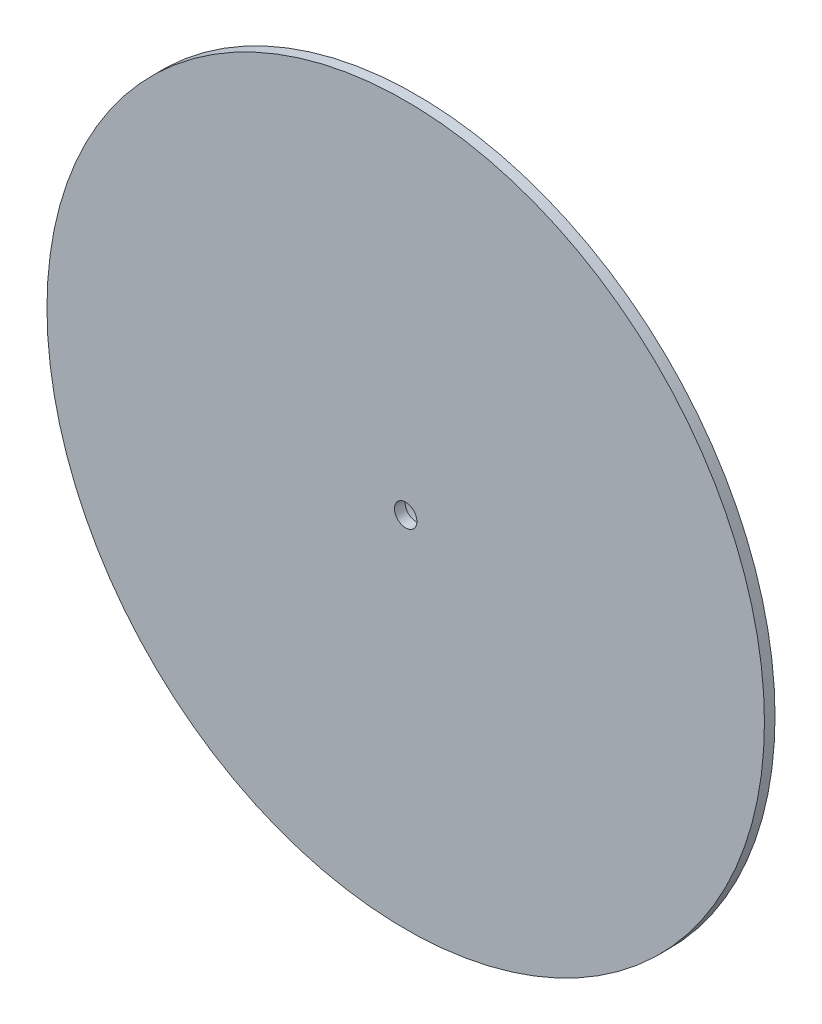
from build123d import *

# Parameters (mm, degrees)
SKETCH1_R               = 9.525
SKETCH1_R_2             = 2.599995
BOSS_EXTRUDE1_DEPTH     = 5
SKETCH2_R               = 25.4
BOSS_EXTRUDE2_DEPTH     = 0.75
SKETCH6_R               = 0.79375
CUT_EXTRUDE2_DEPTH      = 2.54
CUT_EXTRUDE3_REACH      = 45.566
CUT_EXTRUDE3_END_RADIUS = 2.599995
SKETCH7_R               = 1.4


with BuildPart() as part:
    # Sketch1 → Boss-Extrude1 (new body)
    with BuildSketch(Plane.XY):
        Circle(SKETCH1_R)
        Circle(SKETCH1_R_2, mode=Mode.SUBTRACT)
    extrude(amount=BOSS_EXTRUDE1_DEPTH)

    # Sketch2 → Boss-Extrude2 (add)
    with BuildSketch(Plane.XY.offset(5)):
        Circle(SKETCH2_R)
    extrude(amount=BOSS_EXTRUDE2_DEPTH)

    # Sketch6 → Cut-Extrude2 (cut)
    with BuildSketch(Plane.XY.offset(5.75)):
        Circle(SKETCH6_R)
    extrude(amount=-CUT_EXTRUDE2_DEPTH, mode=Mode.SUBTRACT)

    # Cut-Extrude3: up to this cylinder (the profile starts outside it)
    cut_extrude3_end = Plane(origin=(0, 0, 2.5), z_dir=(0, 0, -1)) * Cylinder(CUT_EXTRUDE3_END_RADIUS, 97.33199, mode=Mode.PRIVATE)
    # Sketch7 → Cut-Extrude3 (cut, up to the surface)
    with BuildSketch(Plane(origin=(0, 9.525, 0), x_dir=(1, 0, 0), z_dir=(0, 1, 0)), mode=Mode.PRIVATE) as cut_extrude3_sk1:
        with Locations(Location((0, -2.5, 0), (0, 0, 270))):
            Circle(SKETCH7_R)
    cut_extrude3_tool1 = extrude(cut_extrude3_sk1.sketch, amount=-CUT_EXTRUDE3_REACH, mode=Mode.PRIVATE) - cut_extrude3_end
    add(cut_extrude3_tool1.solids().sort_by_distance((0, 9.525, 2.5))[0], mode=Mode.SUBTRACT)


solid = part.part
